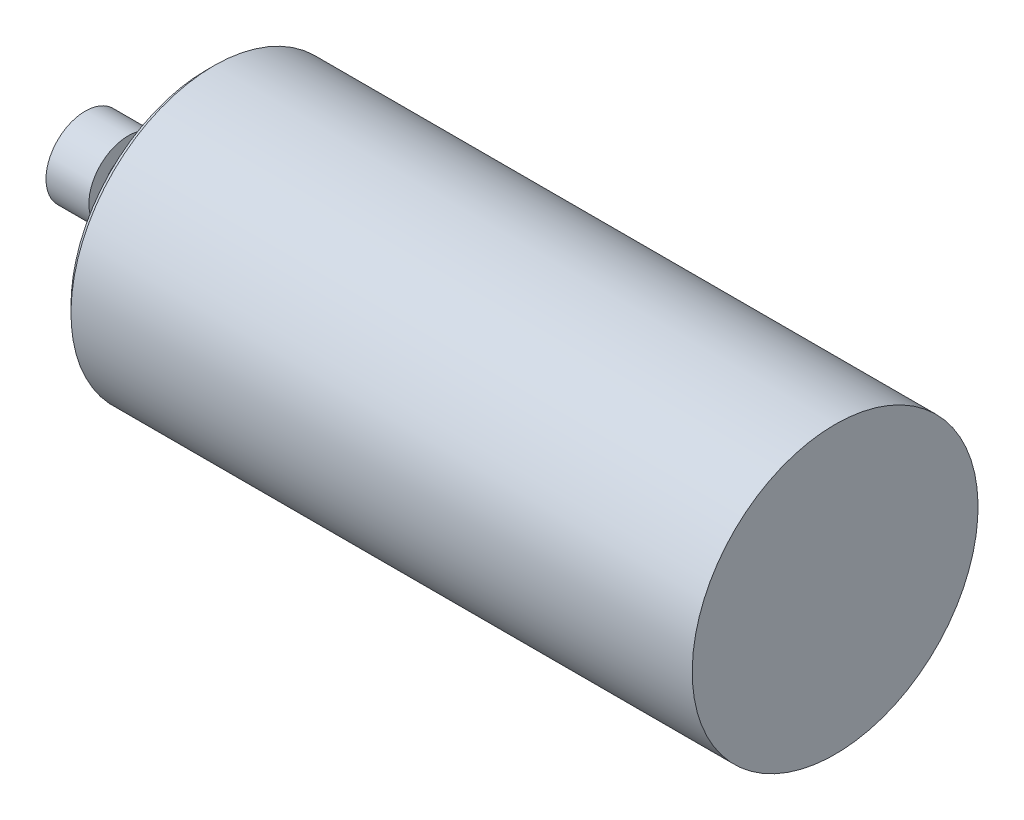
from build123d import *


with BuildPart() as part:
    # Esquisse1 → Révolution1 (revolve)
    with BuildSketch(Plane.XY, mode=Mode.PRIVATE) as r_volution1_sk:
        Polygon((278.635884667, 0), (278.635884667, -40), (258.753503301, -40), (104.753503301, -40), (104.753503301, -38), (102.753503301, -38), (98.753503301, -26), (98.753503301, -17.5), (93.753503301, -17.5), (93.753503301, -7), (80.753503301, -7), (80.753503301, -10.997351134), (68.753503301, -10.997351134), (68.753503301, 0), align=None)
    revolve(r_volution1_sk.sketch.rotate(Axis((278.635884667, 0, 0), (-1, 0, 0)), 180), axis=Axis((278.635884667, 0, 0), (-1, 0, 0)))


solid = part.part
